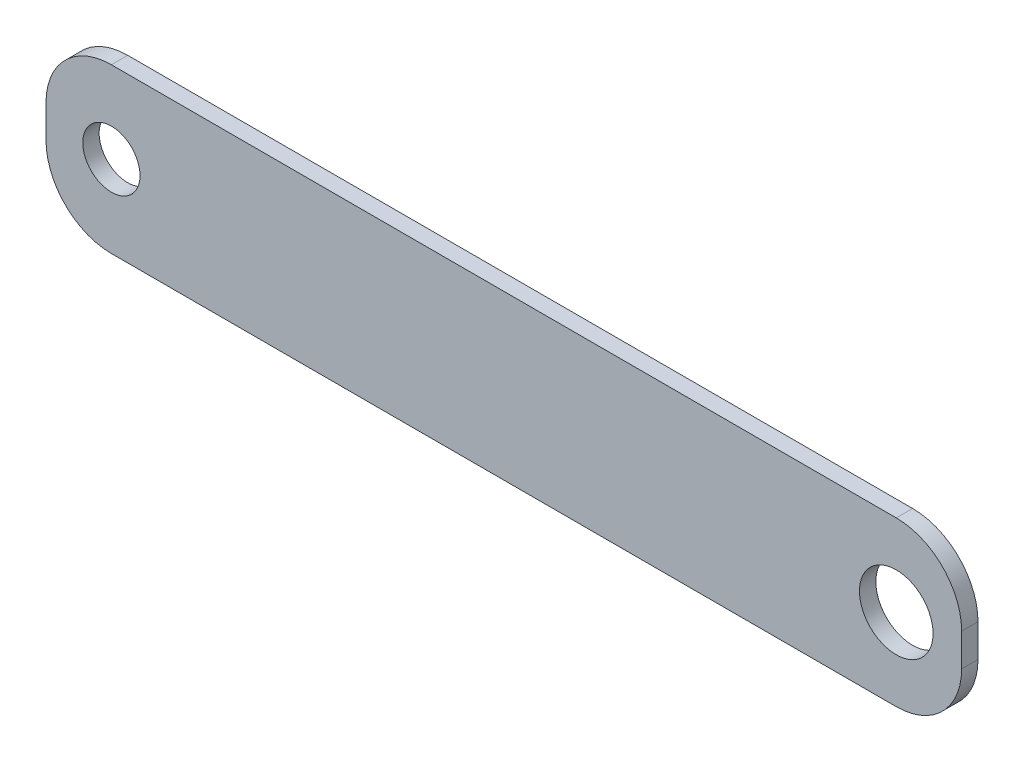
from build123d import *

# Parameters (mm, degrees)
LAYOUT_R            = 11.1125
LAYOUT_R_2          = 14.2875
BOSS_EXTRUDE1_DEPTH = 6.35


with BuildPart() as part:
    # Layout → Boss-Extrude1 (new body)
    with BuildSketch(Plane.XY):
        with BuildLine():
            Line((36.96482124, 44.45), (341.76482124, 44.45))
            ThreePointArc((341.76482124, 44.45), (359.725333482, 51.889487758), (367.16482124, 69.85))
            Line((367.16482124, 69.85), (367.16482124, 82.55))
            ThreePointArc((367.16482124, 82.55), (359.725333482, 100.510512242), (341.76482124, 107.95))
            Line((341.76482124, 107.95), (324.969720877, 107.95))
            Line((324.969720877, 107.95), (211.92127073, 107.95))
            Line((211.92127073, 107.95), (36.96482124, 107.95))
            ThreePointArc((36.96482124, 107.95), (19.004308998, 100.510512242), (11.56482124, 82.55))
            Line((11.56482124, 82.55), (11.56482124, 69.85))
            ThreePointArc((11.56482124, 69.85), (19.004308998, 51.889487758), (36.96482124, 44.45))
        make_face()
        with Locations((36.96482124, 76.2)):
            Circle(LAYOUT_R, mode=Mode.SUBTRACT)
        with Locations((341.76482124, 76.2)):
            Circle(LAYOUT_R_2, mode=Mode.SUBTRACT)
    extrude(amount=BOSS_EXTRUDE1_DEPTH)


solid = part.part
